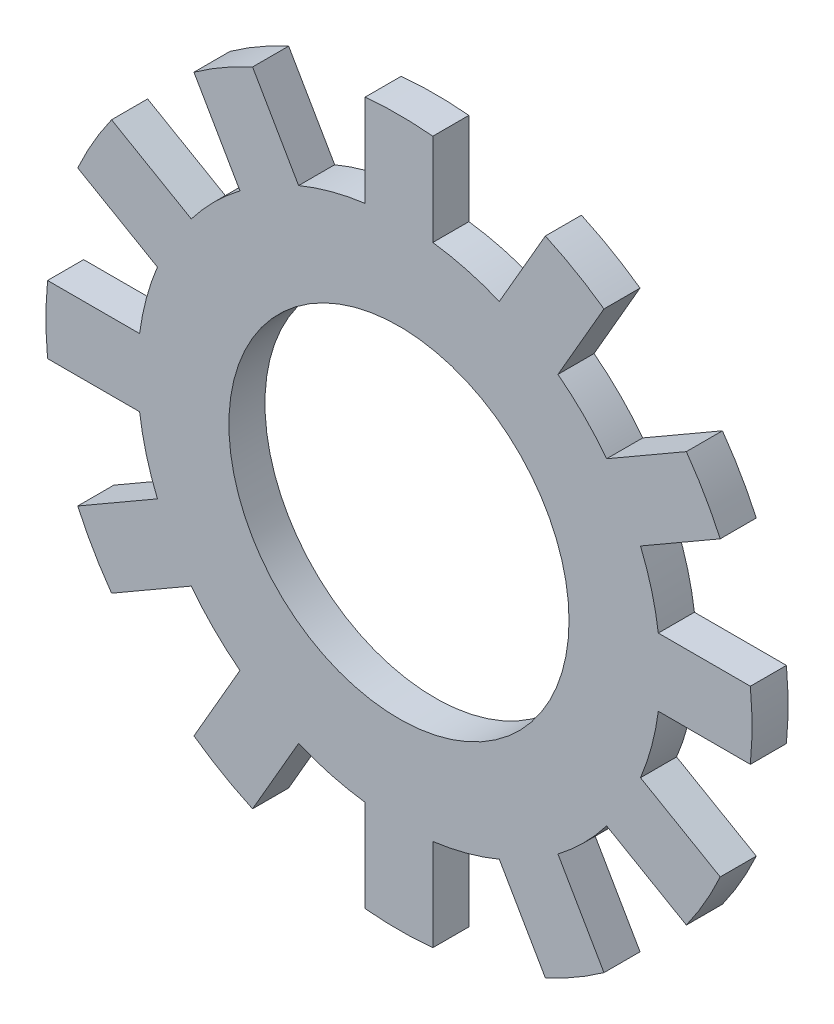
from build123d import *

# Parameters (mm, degrees)
SKETCH1_R         = 2.5375
SKETCH1_R_2       = 1.65
EXTRUDE1_DEPTH    = 0.35
EXTRUDE2_DEPTH    = 0.35
CIRPATTERN1_COUNT = 12


with BuildPart() as part:
    # Sketch1 → Extrude1 (new body)
    with BuildSketch(Plane.XY):
        Circle(SKETCH1_R)
        Circle(SKETCH1_R_2, mode=Mode.SUBTRACT)
    extrude(amount=EXTRUDE1_DEPTH)

    # Sketch2 → Extrude2 (add)
    with BuildSketch(Plane.XY):
        with BuildLine():
            Line((-0.328376663, 3.409221871), (-0.328376663, 2.516162756))
            Line((-0.328376663, 2.516162756), (0.328376663, 2.516162756))
            Line((0.328376663, 2.516162756), (0.328376663, 3.409221871))
            ThreePointArc((0.328376663, 3.409221871), (0, 3.425), (-0.328376663, 3.409221871))
        make_face()
    extrude2 = extrude(amount=EXTRUDE2_DEPTH)

    # CirPattern1: Extrude2 ×12 about axis
    cirpattern1_axis = Axis((0, 0, 0), (0, 0, 1))
    for i in range(1, CIRPATTERN1_COUNT):
        add(extrude2.rotate(cirpattern1_axis, i * 360 / CIRPATTERN1_COUNT))


solid = part.part
